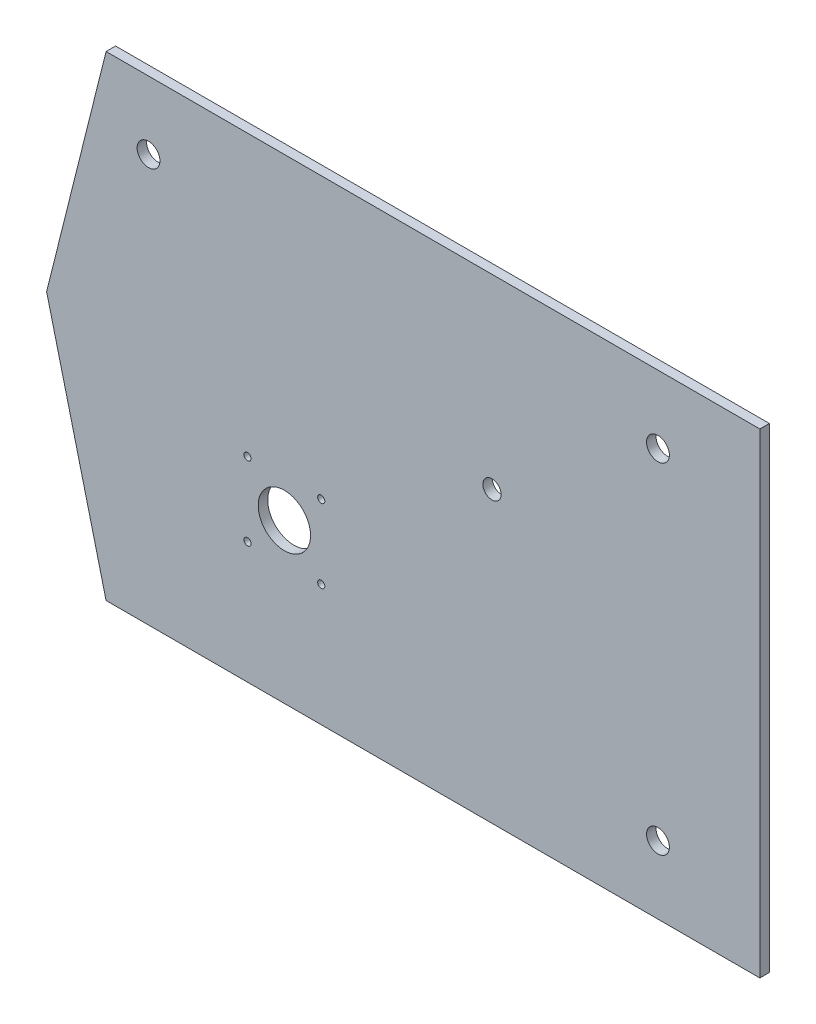
from build123d import *

# Parameters (mm, degrees)
SKETCH1_R           = 1.5
SKETCH1_R_2         = 4.8
SKETCH1_R_3         = 4
BOSS_EXTRUDE1_DEPTH = 4
BOSS_EXTRUDE4_DEPTH = 4
SKETCH1_9_R         = 1.5
SKETCH1_9_R_2       = 11
BOSS_EXTRUDE5_DEPTH = 4
SKETCH1_14_R        = 4
SKETCH1_14_R_2      = 3.85
BOSS_EXTRUDE6_DEPTH = 4
SKETCH1_15_R        = 4
SKETCH1_15_R_2      = 3.85
BOSS_EXTRUDE7_DEPTH = 4


with BuildPart() as part:
    # Sketch1 → Boss-Extrude1 (new body)
    with BuildSketch(Plane.XY):
        Polygon((-125, -100), (150, -100), (150, 100), (-125, 100), (-150, 0), align=None)
        with Locations((-100, -83.333333333)):
            Circle(SKETCH1_R, mode=Mode.SUBTRACT)
        with BuildLine():
            ThreePointArc((-28.85, 11.97315075), (-8.649816618, -5.22350704), (-0.090081146, -30.333333333))
            ThreePointArc((-0.090081146, -30.333333333), (-0.02252536, -31.832657268), (0, -33.333333333))
            ThreePointArc((0, -33.333333333), (-0.02252536, -34.834009399), (-0.090081146, -36.333333333))
            ThreePointArc((-0.090081146, -36.333333333), (-8.649816618, -61.443159627), (-28.85, -78.639817417))
            ThreePointArc((-28.85, -78.639817417), (-50, -83.333333333), (-71.15, -78.639817417))
            ThreePointArc((-71.15, -78.639817417), (-91.350183382, -61.443159627), (-99.909918854, -36.333333333))
            ThreePointArc((-99.909918854, -36.333333333), (-100, -33.333333333), (-99.909918854, -30.333333333))
            ThreePointArc((-99.909918854, -30.333333333), (-91.350183382, -5.22350704), (-71.15, 11.97315075))
            ThreePointArc((-71.15, 11.97315075), (-50, 16.666666667), (-28.85, 11.97315075))
        make_face(mode=Mode.SUBTRACT)
        with Locations((0, -83.333333333)):
            Circle(SKETCH1_R, mode=Mode.SUBTRACT)
        with Locations((107.142857143, -71.428571429)):
            Circle(SKETCH1_R_2, mode=Mode.SUBTRACT)
        with Locations((-100, 16.666666667)):
            Circle(SKETCH1_R, mode=Mode.SUBTRACT)
        with Locations((-107.142857143, 71.428571429)):
            Circle(SKETCH1_R_2, mode=Mode.SUBTRACT)
        with Locations((21.832408692, 6.152026506)):
            Circle(SKETCH1_R, mode=Mode.SUBTRACT)
        with Locations((0, 16.666666667)):
            Circle(SKETCH1_R, mode=Mode.SUBTRACT)
        with Locations((37.332408692, 21.652026506)):
            Circle(SKETCH1_R_3, mode=Mode.SUBTRACT)
        with Locations((52.832408692, 6.152026506)):
            Circle(SKETCH1_R, mode=Mode.SUBTRACT)
        with Locations((21.832408692, 37.152026506)):
            Circle(SKETCH1_R, mode=Mode.SUBTRACT)
        with Locations((52.832408692, 37.152026506)):
            Circle(SKETCH1_R, mode=Mode.SUBTRACT)
        with Locations((107.142857143, 71.428571429)):
            Circle(SKETCH1_R_2, mode=Mode.SUBTRACT)
    extrude(amount=BOSS_EXTRUDE1_DEPTH)

    # Sketch1<8> → Boss-Extrude4 (add)
    with BuildSketch(Plane.XY):
        with BuildLine():
            Line((-28.85, 11.97315075), (-28.85, 0.617771214))
            ThreePointArc((-28.85, 0.617771214), (-10, -33.333333333), (-28.85, -67.284437881))
            Line((-28.85, -67.284437881), (-28.85, -78.639817417))
            ThreePointArc((-28.85, -78.639817417), (0, -33.333333333), (-28.85, 11.97315075))
        make_face()
        with BuildLine():
            ThreePointArc((-71.15, 11.97315075), (-100, -33.333333333), (-71.15, -78.639817417))
            Line((-71.15, -78.639817417), (-71.15, -67.284437881))
            ThreePointArc((-71.15, -67.284437881), (-90, -33.333333333), (-71.15, 0.617771214))
            Line((-71.15, 0.617771214), (-71.15, 11.97315075))
        make_face()
    extrude(amount=BOSS_EXTRUDE4_DEPTH)

    # Sketch1<9> → Boss-Extrude5 (add)
    # profile 1 of 9: a face of its own
    with BuildSketch(Plane.XY):
        with BuildLine():
            ThreePointArc((-28.85, 11.97315075), (-50, 16.666666667), (-71.15, 11.97315075))
            Line((-71.15, 11.97315075), (-71.15, 0.617771214))
            ThreePointArc((-71.15, 0.617771214), (-90, -33.333333333), (-71.15, -67.284437881))
            Line((-71.15, -67.284437881), (-71.15, -78.639817417))
            ThreePointArc((-71.15, -78.639817417), (-50, -83.333333333), (-28.85, -78.639817417))
            Line((-28.85, -78.639817417), (-28.85, -67.284437881))
            ThreePointArc((-28.85, -67.284437881), (-10, -33.333333333), (-28.85, 0.617771214))
            Line((-28.85, 0.617771214), (-28.85, 11.97315075))
        make_face()
        with Locations((-34.5, -17.833333333)):
            Circle(SKETCH1_9_R, mode=Mode.SUBTRACT)
        with Locations((-65.5, -48.833333333)):
            Circle(SKETCH1_9_R, mode=Mode.SUBTRACT)
        with Locations((-50, -33.333333333)):
            Circle(SKETCH1_9_R_2, mode=Mode.SUBTRACT)
        with Locations((-34.5, -48.833333333)):
            Circle(SKETCH1_9_R, mode=Mode.SUBTRACT)
        with Locations((-65.5, -17.833333333)):
            Circle(SKETCH1_9_R, mode=Mode.SUBTRACT)
    # profile 2 of 9: a face of its own
    with BuildSketch(Plane.XY):
        with Locations((21.832408692, 37.152026506)):
            Circle(SKETCH1_9_R)
    # profile 3 of 9: a face of its own
    with BuildSketch(Plane.XY):
        with Locations((52.832408692, 37.152026506)):
            Circle(SKETCH1_9_R)
    # profile 4 of 9: a face of its own
    with BuildSketch(Plane.XY):
        with Locations((52.832408692, 6.152026506)):
            Circle(SKETCH1_9_R)
    # profile 5 of 9: a face of its own
    with BuildSketch(Plane.XY):
        with Locations((21.832408692, 6.152026506)):
            Circle(SKETCH1_9_R)
    # profile 6 of 9: a face of its own
    with BuildSketch(Plane.XY):
        with Locations((-100, 16.666666667)):
            Circle(SKETCH1_9_R)
    # profile 7 of 9: a face of its own
    with BuildSketch(Plane.XY):
        with Locations((0, 16.666666667)):
            Circle(SKETCH1_9_R)
    # profile 8 of 9: a face of its own
    with BuildSketch(Plane.XY):
        with Locations((0, -83.333333333)):
            Circle(SKETCH1_9_R)
    # profile 9 of 9: a face of its own
    with BuildSketch(Plane.XY):
        with Locations((-100, -83.333333333)):
            Circle(SKETCH1_9_R)
    extrude(amount=BOSS_EXTRUDE5_DEPTH)

    # Sketch1<14> → Boss-Extrude6 (add)
    with BuildSketch(Plane.XY):
        with Locations((37.332408692, 21.652026506)):
            Circle(SKETCH1_14_R)
        with Locations((37.332408692, 21.652026506)):
            Circle(SKETCH1_14_R_2, mode=Mode.SUBTRACT)
    extrude(amount=BOSS_EXTRUDE6_DEPTH)

    # Sketch1<15> → Boss-Extrude7 (add)
    with BuildSketch(Plane.XY):
        with Locations((37.332408692, 21.652026506)):
            Circle(SKETCH1_15_R)
        with Locations((37.332408692, 21.652026506)):
            Circle(SKETCH1_15_R_2, mode=Mode.SUBTRACT)
    extrude(amount=BOSS_EXTRUDE7_DEPTH)


solid = part.part
